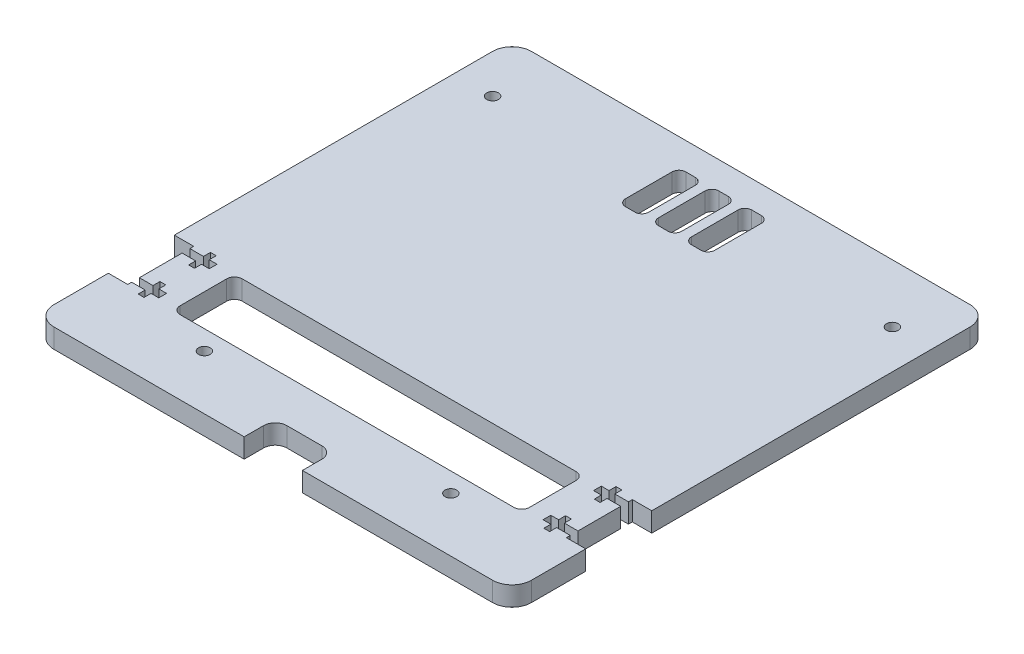
from build123d import *

# Parameters (mm, degrees)
RESSALTO_EXTRUS_O1_DEPTH = 5
CORTE_EXTRUS_O1_DEPTH    = 5
ESBO_O3_W                = 5
ESBO_O3_H                = 17
CORTE_EXTRUS_O3_DEPTH    = 5
CORTE_EXTRUS_O4_DEPTH    = 10
CORTE_EXTRUS_O5_DEPTH    = 5
ESBO_O6_R                = 1.5
CORTE_EXTRUS_O6_DEPTH    = 20
CORTE_EXTRUS_O7_DEPTH    = 10


with BuildPart() as part:
    # Esboço1 → Ressalto-extrusão1 (new body)
    with BuildSketch(Plane(origin=(0, 0, 0), x_dir=(1, 0, 0), z_dir=(0, 1, 0))):
        with BuildLine():
            Line((-56.5, -61.5), (56.5, -61.5))
            ThreePointArc((56.5, -61.5), (60.035533906, -60.035533906), (61.5, -56.5))
            Line((61.5, -56.5), (61.5, 56.5))
            ThreePointArc((61.5, 56.5), (60.035533906, 60.035533906), (56.5, 61.5))
            Line((56.5, 61.5), (-56.5, 61.5))
            ThreePointArc((-56.5, 61.5), (-60.035533906, 60.035533906), (-61.5, 56.5))
            Line((-61.5, 56.5), (-61.5, -56.5))
            ThreePointArc((-61.5, -56.5), (-60.035533906, -60.035533906), (-56.5, -61.5))
        make_face()
    extrude(amount=RESSALTO_EXTRUS_O1_DEPTH)

    # Esboço2 → Corte-extrusão1 (cut)
    with BuildSketch(Plane(origin=(0, 5, 0), x_dir=(1, 0, 0), z_dir=(0, 1, 0))):
        with BuildLine():
            Line((1.233117681, 54.5), (-1.233117681, 54.5))
            ThreePointArc((-1.233117681, 54.5), (-2.48249215, 53.98249215), (-3, 52.733117681))
            Line((-3, 52.733117681), (-3, 40.733117681))
            ThreePointArc((-3, 40.733117681), (-2.48249215, 39.483743212), (-1.233117681, 38.966235362))
            Line((-1.233117681, 38.966235362), (1.233117681, 38.966235362))
            ThreePointArc((1.233117681, 38.966235362), (2.48249215, 39.483743212), (3, 40.733117681))
            Line((3, 40.733117681), (3, 52.733117681))
            ThreePointArc((3, 52.733117681), (2.48249215, 53.98249215), (1.233117681, 54.5))
        make_face()
        with BuildLine():
            Line((-7.266882319, 54.5), (-9.733117681, 54.5))
            ThreePointArc((-9.733117681, 54.5), (-10.98249215, 53.98249215), (-11.5, 52.733117681))
            Line((-11.5, 52.733117681), (-11.5, 40.733117681))
            ThreePointArc((-11.5, 40.733117681), (-10.98249215, 39.483743212), (-9.733117681, 38.966235362))
            Line((-9.733117681, 38.966235362), (-7.266882319, 38.966235362))
            ThreePointArc((-7.266882319, 38.966235362), (-6.01750785, 39.483743212), (-5.5, 40.733117681))
            Line((-5.5, 40.733117681), (-5.5, 52.733117681))
            ThreePointArc((-5.5, 52.733117681), (-6.01750785, 53.98249215), (-7.266882319, 54.5))
        make_face()
        with BuildLine():
            Line((7.266882319, 38.966235362), (9.733117681, 38.966235362))
            ThreePointArc((9.733117681, 38.966235362), (10.98249215, 39.483743212), (11.5, 40.733117681))
            Line((11.5, 40.733117681), (11.5, 52.733117681))
            ThreePointArc((11.5, 52.733117681), (10.98249215, 53.98249215), (9.733117681, 54.5))
            Line((9.733117681, 54.5), (7.266882319, 54.5))
            ThreePointArc((7.266882319, 54.5), (6.01750785, 53.98249215), (5.5, 52.733117681))
            Line((5.5, 52.733117681), (5.5, 40.733117681))
            ThreePointArc((5.5, 40.733117681), (6.01750785, 39.483743212), (7.266882319, 38.966235362))
        make_face()
    extrude(amount=-CORTE_EXTRUS_O1_DEPTH, mode=Mode.SUBTRACT)

    # Esboço3 → Corte-extrusão3 (cut)
    with BuildSketch(Plane(origin=(0, 5, 0), x_dir=(1, 0, 0), z_dir=(0, 1, 0))):
        with Locations((-59, -34)):
            Rectangle(ESBO_O3_W, ESBO_O3_H)
        with Locations((59, -34)):
            Rectangle(ESBO_O3_W, ESBO_O3_H)
    extrude(amount=-CORTE_EXTRUS_O3_DEPTH, mode=Mode.SUBTRACT)

    # Esboço4 → Corte-extrusão4 (cut)
    with BuildSketch(Plane(origin=(0, 5, 0), x_dir=(1, 0, 0), z_dir=(0, 1, 0))):
        Polygon((56.5, -41.5), (53, -41.5), (53, -43.3), (51.5, -43.3), (51.5, -41.5), (49.5, -41.5), (49.5, -39.5), (51.5, -39.5), (51.5, -37.7), (53, -37.7), (53, -39.5), (56.5, -39.5), align=None)
        Polygon((56.5, -26.5), (53, -26.5), (53, -24.7), (51.5, -24.7), (51.5, -26.5), (49.5, -26.5), (49.5, -28.5), (51.5, -28.5), (51.5, -30.3), (53, -30.3), (53, -28.5), (56.5, -28.5), align=None)
    corte_extrus_o4 = extrude(amount=-CORTE_EXTRUS_O4_DEPTH, mode=Mode.SUBTRACT)

    # Espelhar1: Corte-extrusão4 across plane
    add(corte_extrus_o4.mirror(Plane(origin=(0, 0, 0), x_dir=(0, 0, 1), z_dir=(1, 0, 0))), mode=Mode.SUBTRACT)

    # Esboço5 → Corte-extrusão5 (cut)
    with BuildSketch(Plane(origin=(0, 5, 0), x_dir=(1, 0, 0), z_dir=(0, 1, 0))):
        with BuildLine():
            Line((43, -42.5), (-43, -42.5))
            ThreePointArc((-43, -42.5), (-44.414213562, -41.914213562), (-45, -40.5))
            Line((-45, -40.5), (-45, -28.5))
            ThreePointArc((-45, -28.5), (-44.414213562, -27.085786438), (-43, -26.5))
            Line((-43, -26.5), (43, -26.5))
            ThreePointArc((43, -26.5), (44.414213562, -27.085786438), (45, -28.5))
            Line((45, -28.5), (45, -40.5))
            ThreePointArc((45, -40.5), (44.414213562, -41.914213562), (43, -42.5))
        make_face()
    extrude(amount=-CORTE_EXTRUS_O5_DEPTH, mode=Mode.SUBTRACT)

    # Esboço6 → Corte-extrusão6 (cut)
    with BuildSketch(Plane(origin=(0, 5, 0), x_dir=(1, 0, 0), z_dir=(0, 1, 0))):
        with Locations(Location((-51.5, 46.5, 0), (0, 0, 270))):
            Circle(ESBO_O6_R)
        with Locations(Location((51.5, 46.5, 0), (0, 0, 270))):
            Circle(ESBO_O6_R)
        with Locations(Location((31.75, -47.5, 0), (0, 0, 270))):
            Circle(ESBO_O6_R)
        with Locations(Location((-31.75, -47.5, 0), (0, 0, 270))):
            Circle(ESBO_O6_R)
    extrude(amount=-CORTE_EXTRUS_O6_DEPTH, mode=Mode.SUBTRACT)

    # Esboço7 → Corte-extrusão7 (cut)
    with BuildSketch(Plane.XZ):
        with BuildLine():
            Line((7.5, 61.5), (-7.5, 61.5))
            Line((-7.5, 61.5), (-7.5, 56.5))
            ThreePointArc((-7.5, 56.5), (-6.621320344, 54.378679656), (-4.5, 53.5))
            Line((-4.5, 53.5), (4.5, 53.5))
            ThreePointArc((4.5, 53.5), (6.621320344, 54.378679656), (7.5, 56.5))
            Line((7.5, 56.5), (7.5, 61.5))
        make_face()
    extrude(amount=-CORTE_EXTRUS_O7_DEPTH, mode=Mode.SUBTRACT)


solid = part.part
